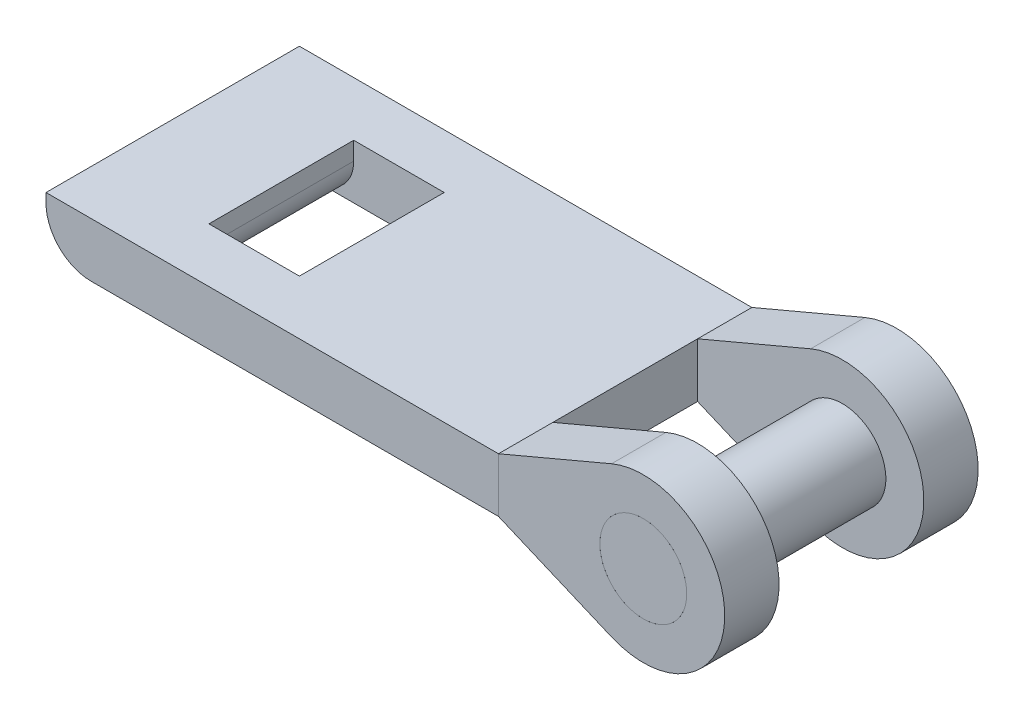
from build123d import *

# Parameters (mm, degrees)
SKETCH_1_R          = 2.4
EXTRUDE_1_DEPTH     = 7
SKETCH_2_R          = 2.4
EXTRUDE_2_DEPTH     = 3
SKETCH_3_W          = 14
SKETCH_3_H          = 3
EXTRUDE_3_DEPTH     = 22
SKETCH_4_W          = 5
SKETCH_4_H          = 8
CUT_EXTRUDE_4_DEPTH = 20.779724268
FILLET_1_R          = 2
SKETCH_5_W          = 14
SKETCH_5_H          = 3
EXTRUDE_4_DEPTH     = 3
FILLET_2_R          = 2.5


with BuildPart() as part:
    # Эскиз1 → Бобышка-Вытянуть1 (new, symmetric)
    with BuildSketch(Plane.XY):
        with Locations((12.999642628, 35.197201498)):
            Circle(SKETCH_1_R)
    extrude(amount=EXTRUDE_1_DEPTH, both=True)


with BuildPart() as body_2:
    # Эскиз2 → Бобышка-Вытянуть2 (new body)
    with BuildSketch(Plane(origin=(0, 0, -7), x_dir=(-1, 0, 0), z_dir=(0, 0, -1))):
        with BuildLine():
            Line((-11.245389457, 39.341184584), (-4.999642628, 36.697201498))
            Line((-4.999642628, 36.697201498), (-4.999642628, 33.697201498))
            Line((-4.999642628, 33.697201498), (-11.245389457, 31.053218413))
            ThreePointArc((-11.245389457, 31.053218413), (-17.499642628, 35.197201498), (-11.245389457, 39.341184584))
        make_face()
        with Locations((-12.999642628, 35.197201498)):
            Circle(SKETCH_2_R, mode=Mode.SUBTRACT)
    extrude(amount=-EXTRUDE_2_DEPTH)


with BuildPart() as body_3:
    # Зеркальное отражение2: mirrored copy
    add(body_2.part.mirror(Plane.XY))


with BuildPart() as body_4:
    # Эскиз3 → Бобышка-Вытянуть3 (new body)
    with BuildSketch(Plane.ZY.offset(-4.999642628)):
        with Locations((0, 35.197201498)):
            Rectangle(SKETCH_3_W, SKETCH_3_H)
    extrude(amount=EXTRUDE_3_DEPTH)

    # Эскиз4 → Вырез-Вытянуть4 (cut, through all)
    with BuildSketch(Plane(origin=(0, 36.697201498, 0), x_dir=(1, 0, 0), z_dir=(0, 1, 0))):
        with Locations((-11.500357372, 0)):
            Rectangle(SKETCH_4_W, SKETCH_4_H)
    extrude(amount=-CUT_EXTRUDE_4_DEPTH, mode=Mode.SUBTRACT)

    # Скругление1
    fillet_1_edges = [body_4.edges().sort_by_distance(p)[0] for p in [
        (-14.000357372, 33.697201498, 0),
    ]]
    fillet(fillet_1_edges, radius=FILLET_1_R)

    # Эскиз5 → Бобышка-Вытянуть4 (add)
    with BuildSketch(Plane.ZY.offset(17.000357372)):
        with Locations((0, 35.197201498)):
            Rectangle(SKETCH_5_W, SKETCH_5_H)
    extrude(amount=EXTRUDE_4_DEPTH)

    # Скругление2
    fillet_2_edges = [body_4.edges().sort_by_distance(p)[0] for p in [
        (-20.000357372, 33.697201498, 0),
    ]]
    fillet(fillet_2_edges, radius=FILLET_2_R)


solid = Compound([part.part, body_2.part, body_3.part, body_4.part])
